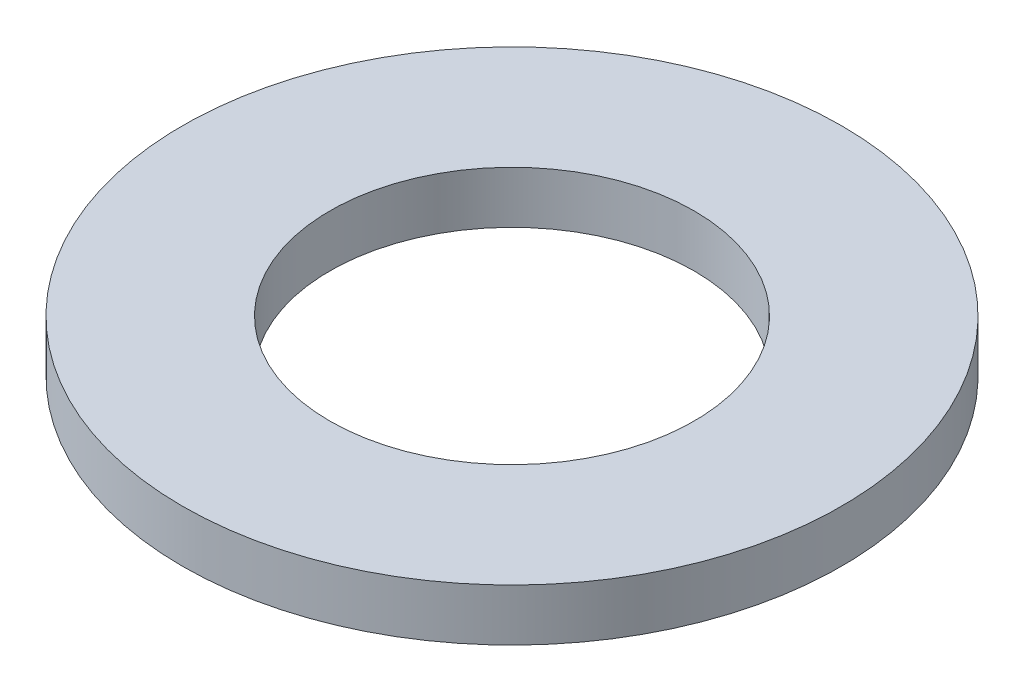
from build123d import *

# Parameters (mm, degrees)
SKETCH1_R           = 38
SKETCH1_R_2         = 21
BOSS_EXTRUDE1_DEPTH = 6


with BuildPart() as part:
    # Sketch1 → Boss-Extrude1 (new body)
    with BuildSketch(Plane(origin=(0, 0, 0), x_dir=(1, 0, 0), z_dir=(0, 1, 0))):
        with Locations(Location((0, 0, 0), (0, 0, 270))):
            Circle(SKETCH1_R)
        with Locations(Location((0, 0, 0), (0, 0, 270))):
            Circle(SKETCH1_R_2, mode=Mode.SUBTRACT)
    extrude(amount=BOSS_EXTRUDE1_DEPTH)


solid = part.part
